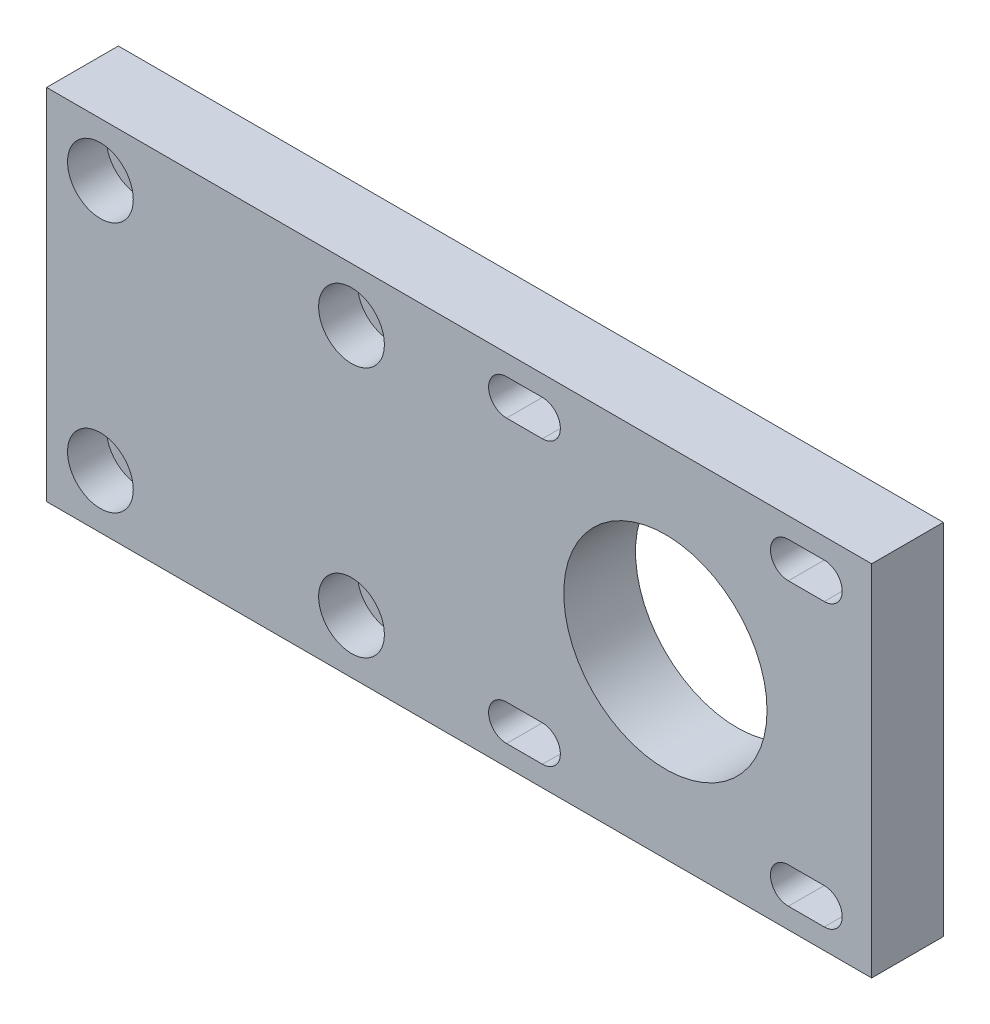
from build123d import *

# Parameters (mm, degrees)
SZKIC1_W                                             = 138
SZKIC1_H                                             = 60
SZKIC1_R                                             = 17
DODANIE_WYCI_GNI_CIE1_DEPTH                          = 12
POG_BIENIE_WALCOWE_POD_M5_WKR_T_DO_CZ_CI_D           = 5.5
POG_BIENIE_WALCOWE_POD_M5_WKR_T_DO_CZ_CI_CBORE_D     = 11
POG_BIENIE_WALCOWE_POD_M5_WKR_T_DO_CZ_CI_CBORE_DEPTH = 6.5
WYTNIJ_WYCI_GNI_CIE1_DEPTH                           = 5
WYTNIJ_WYCI_GNI_CIE2_DEPTH                           = 367.809214715


with BuildPart() as part:
    # Szkic1 → Dodanie-wyciągnięcie1 (new body)
    with BuildSketch(Plane.XY):
        with Locations((-1, 330)):
            Rectangle(SZKIC1_W, SZKIC1_H)
        with Locations((33.5, 330)):
            Circle(SZKIC1_R, mode=Mode.SUBTRACT)
    extrude(amount=DODANIE_WYCI_GNI_CIE1_DEPTH)

    # Pogłębienie walcowe pod M5 Wkręt do części metalowych z łbem sześciokątnym1 (through all)
    with Locations(Plane.XY.offset(12)):
        with Locations((-61, 351), (-19, 351), (-61, 309), (-19, 309)):
            CounterBoreHole(POG_BIENIE_WALCOWE_POD_M5_WKR_T_DO_CZ_CI_D / 2, POG_BIENIE_WALCOWE_POD_M5_WKR_T_DO_CZ_CI_CBORE_D / 2, POG_BIENIE_WALCOWE_POD_M5_WKR_T_DO_CZ_CI_CBORE_DEPTH)

    # Szkic5 → Wytnij-wyciągnięcie1 (cut)
    with BuildSketch(Plane(origin=(0, 0, 0), x_dir=(-1, 0, 0), z_dir=(0, 0, -1))):
        with BuildLine():
            Line((-12.93, 358.07), (-6.93, 358.07))
            ThreePointArc((-6.93, 358.07), (-2.43, 353.57), (-6.93, 349.07))
            Line((-6.93, 349.07), (-12.93, 349.07))
            ThreePointArc((-12.93, 349.07), (-17.43, 353.57), (-12.93, 358.07))
        make_face()
        with BuildLine():
            Line((-60.07, 358.07), (-54.07, 358.07))
            ThreePointArc((-54.07, 358.07), (-49.57, 353.57), (-54.07, 349.07))
            Line((-54.07, 349.07), (-60.07, 349.07))
            ThreePointArc((-60.07, 349.07), (-64.57, 353.57), (-60.07, 358.07))
        make_face()
    wytnij_wyci_gni_cie1 = extrude(amount=-WYTNIJ_WYCI_GNI_CIE1_DEPTH, mode=Mode.SUBTRACT)

    # Szkic7 → Wytnij-wyciągnięcie2 (cut, through all)
    with BuildSketch(Plane(origin=(0, 0, 5), x_dir=(-1, 0, 0), z_dir=(0, 0, -1))):
        with BuildLine():
            Line((-60.07, 350.57), (-54.07, 350.57))
            ThreePointArc((-54.07, 350.57), (-51.07, 353.57), (-54.07, 356.57))
            Line((-54.07, 356.57), (-60.07, 356.57))
            ThreePointArc((-60.07, 356.57), (-63.07, 353.57), (-60.07, 350.57))
        make_face()
        with BuildLine():
            Line((-12.93, 350.57), (-6.93, 350.57))
            ThreePointArc((-6.93, 350.57), (-3.93, 353.57), (-6.93, 356.57))
            Line((-6.93, 356.57), (-12.93, 356.57))
            ThreePointArc((-12.93, 356.57), (-15.93, 353.57), (-12.93, 350.57))
        make_face()
    wytnij_wyci_gni_cie2 = extrude(amount=-WYTNIJ_WYCI_GNI_CIE2_DEPTH, mode=Mode.SUBTRACT)

    # Lustro1: Wytnij-wyciągnięcie1, Wytnij-wyciągnięcie2 across plane
    add(wytnij_wyci_gni_cie1.mirror(Plane.ZX.offset(330)), mode=Mode.SUBTRACT)
    add(wytnij_wyci_gni_cie2.mirror(Plane.ZX.offset(330)), mode=Mode.SUBTRACT)


solid = part.part
